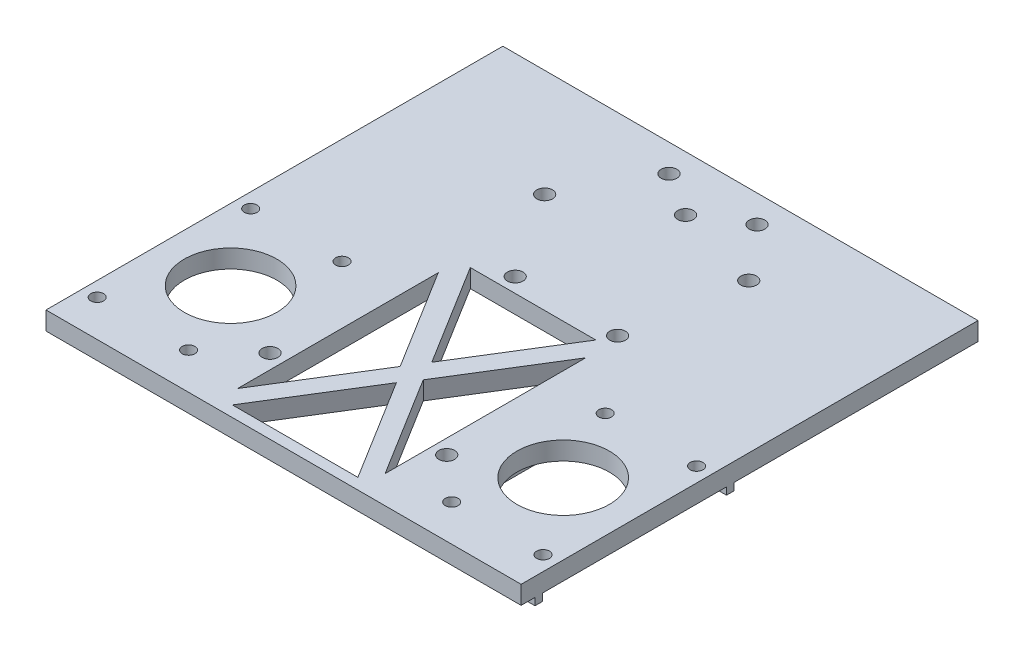
from build123d import *

# Parameters (mm, degrees)
SKETCH1_W           = 130
SKETCH1_H           = 125
BOSS_EXTRUDE1_DEPTH = 5
SKETCH2_R           = 1.75
SKETCH2_R_2         = 12.65
CUT_EXTRUDE1_DEPTH  = 10
SKETCH3_R           = 2.15
CUT_EXTRUDE2_DEPTH  = 10
SKETCH4_R           = 2.15
CUT_EXTRUDE3_DEPTH  = 10
BOSS_EXTRUDE2_DEPTH = 2
SKETCH6_R           = 2.65
CUT_EXTRUDE5_DEPTH  = 0.5
CUT_EXTRUDE7_DEPTH  = 91.444734507


with BuildPart() as part:
    # Sketch1 → Boss-Extrude1 (new body)
    with BuildSketch(Plane(origin=(0, 0, 0), x_dir=(1, 0, 0), z_dir=(0, 1, 0))):
        Rectangle(SKETCH1_W, SKETCH1_H)
    extrude(amount=BOSS_EXTRUDE1_DEPTH)

    # Sketch2 → Cut-Extrude1 (cut)
    with BuildSketch(Plane(origin=(0, 5, 0), x_dir=(1, 0, 0), z_dir=(0, 1, 0))):
        with Locations(Location((-61, -52.5, 0), (0, 0, 270))):
            Circle(SKETCH2_R)
        with Locations(Location((-36, -52.5, 0), (0, 0, 270))):
            Circle(SKETCH2_R)
        with Locations(Location((-36, -10.5, 0), (0, 0, 270))):
            Circle(SKETCH2_R)
        with Locations(Location((-61, -10.5, 0), (0, 0, 270))):
            Circle(SKETCH2_R)
        with Locations(Location((-45.5, -31.5, 0), (0, 0, 270))):
            Circle(SKETCH2_R_2)
    cut_extrude1 = extrude(amount=-CUT_EXTRUDE1_DEPTH, mode=Mode.SUBTRACT)

    # Mirror3: Cut-Extrude1 across plane
    add(cut_extrude1.mirror(Plane.ZY), mode=Mode.SUBTRACT)

    # Sketch3 → Cut-Extrude2 (cut)
    with BuildSketch(Plane(origin=(0, 5, 0), x_dir=(1, 0, 0), z_dir=(0, 1, 0))):
        with Locations(Location((-24.17, -42.03, 0), (0, 0, 270))):
            Circle(SKETCH3_R)
        with Locations(Location((24.17, -42.03, 0), (0, 0, 270))):
            Circle(SKETCH3_R)
        with Locations(Location((-8.73, 9.6, 0), (0, 0, 270))):
            Circle(SKETCH3_R)
        with Locations(Location((19.29, 9.6, 0), (0, 0, 270))):
            Circle(SKETCH3_R)
        with Locations(Location((-24.17, 33.11, 0), (0, 0, 270))):
            Circle(SKETCH3_R)
        with Locations(Location((24.17, 40.6, 0), (0, 0, 270))):
            Circle(SKETCH3_R)
    extrude(amount=-CUT_EXTRUDE2_DEPTH, mode=Mode.SUBTRACT)

    # Sketch4 → Cut-Extrude3 (cut)
    with BuildSketch(Plane(origin=(0, 5, 0), x_dir=(1, 0, 0), z_dir=(0, 1, 0))):
        with Locations(Location((0, 47.5, 0), (0, 0, 270))):
            Circle(SKETCH4_R)
        with Locations(Location((12.049810205, 55, 0), (0, 0, 270))):
            Circle(SKETCH4_R)
        with Locations(Location((-12.049810205, 55, 0), (0, 0, 270))):
            Circle(SKETCH4_R)
    extrude(amount=-CUT_EXTRUDE3_DEPTH, mode=Mode.SUBTRACT)

    # Sketch5 → Boss-Extrude2 (add)
    with BuildSketch(Plane.XZ):
        Polygon((-65, 58.7), (-65, 56.7), (-31.6, 56.7), (-31.6, 6.3), (-65, 6.3), (-65, 4.3), (-29.6, 4.3), (-29.6, 58.7), align=None)
    boss_extrude2 = extrude(amount=BOSS_EXTRUDE2_DEPTH)

    # Mirror6: Boss-Extrude2 across plane
    add(boss_extrude2.mirror(Plane.ZY))

    # Sketch6 → Cut-Extrude5 (cut)
    with BuildSketch(Plane.XZ):
        with Locations(Location((-8.73, -9.6, 0), (0, 0, 270))):
            Circle(SKETCH6_R)
        with Locations(Location((19.29, -9.6, 0), (0, 0, 270))):
            Circle(SKETCH6_R)
        with Locations(Location((-24.17, -33.11, 0), (0, 0, 270))):
            Circle(SKETCH6_R)
        with Locations(Location((24.17, -40.6, 0), (0, 0, 270))):
            Circle(SKETCH6_R)
        with Locations(Location((0, -47.5, 0), (0, 0, 270))):
            Circle(SKETCH6_R)
        with Locations(Location((-12.049810205, -55, 0), (0, 0, 270))):
            Circle(SKETCH6_R)
        with Locations(Location((12.049810205, -55, 0), (0, 0, 270))):
            Circle(SKETCH6_R)
        with Locations(Location((-61, 10.5, 0), (0, 0, 270))):
            Circle(SKETCH6_R)
        with Locations(Location((-36, 10.5, 0), (0, 0, 270))):
            Circle(SKETCH6_R)
        with Locations(Location((-36, 52.5, 0), (0, 0, 270))):
            Circle(SKETCH6_R)
        with Locations(Location((-61, 52.5, 0), (0, 0, 270))):
            Circle(SKETCH6_R)
        with Locations(Location((36, 52.5, 0), (0, 0, 270))):
            Circle(SKETCH6_R)
        with Locations(Location((36, 10.5, 0), (0, 0, 270))):
            Circle(SKETCH6_R)
        with Locations(Location((61, 10.5, 0), (0, 0, 270))):
            Circle(SKETCH6_R)
        with Locations(Location((61, 52.5, 0), (0, 0, 270))):
            Circle(SKETCH6_R)
        with Locations(Location((-24.17, 42.03, 0), (0, 0, 270))):
            Circle(SKETCH6_R)
        with Locations(Location((24.17, 42.03, 0), (0, 0, 270))):
            Circle(SKETCH6_R)
    extrude(amount=-CUT_EXTRUDE5_DEPTH, mode=Mode.SUBTRACT)

    # Sketch7 → Cut-Extrude7 (cut, through all)
    with BuildSketch(Plane(origin=(0, 5, 0), x_dir=(1, 0, 0), z_dir=(0, 1, 0))):
        Polygon((-3.163736655, -27.444416058), (-20.17, 0), (-20.17, -54.888832116), align=None)
        Polygon((17.332982786, 5.6), (-17.003730784, 5.6), (0.164626001, -22.10599967), align=None)
        Polygon((20.17, -54.888832116), (20.17, 0), (3.163736655, -27.444416058), align=None)
        Polygon((0.164626001, -31.79400033), (-17.003730784, -59.5), (17.332982786, -59.5), align=None)
    extrude(amount=-CUT_EXTRUDE7_DEPTH, mode=Mode.SUBTRACT)


solid = part.part
